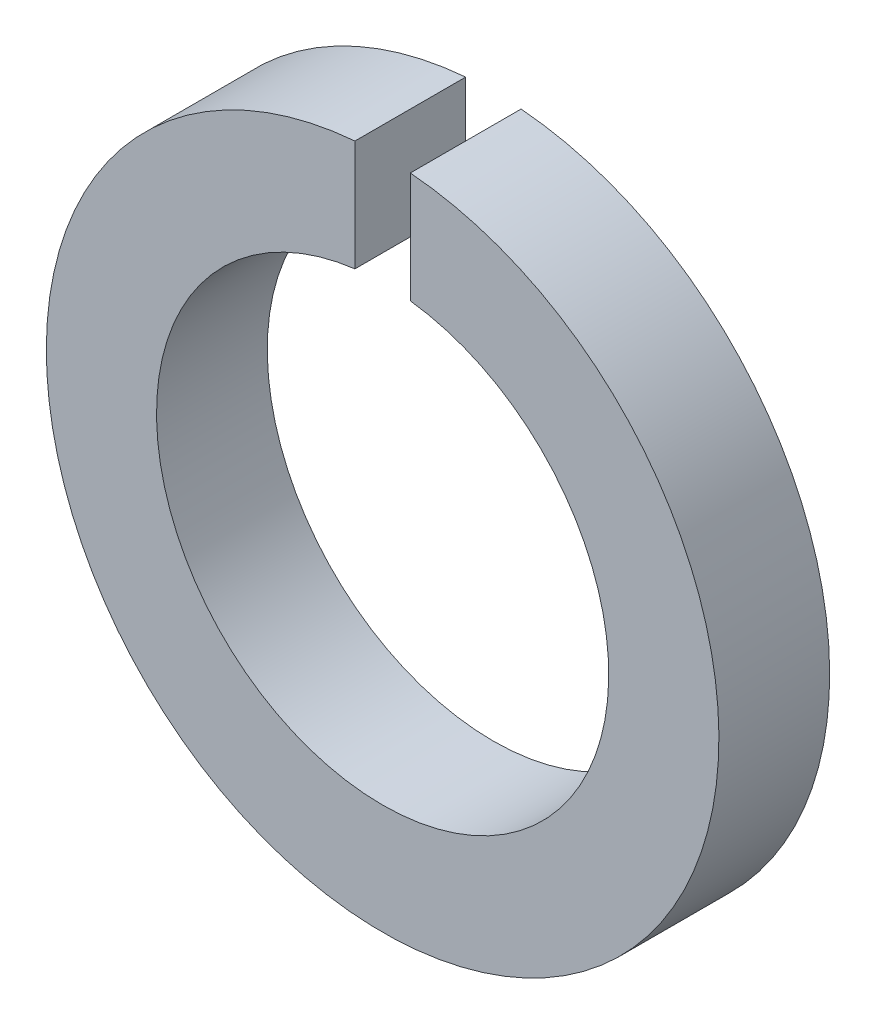
from build123d import *

# Parameters (mm, degrees)
EXTRUDE_1_DEPTH = 6


with BuildPart() as part:
    # 草图1 → 拉伸1 (new body)
    with BuildSketch(Plane.XY):
        with BuildLine():
            Line((-1.5, 18.157816416), (-1.5, 12.157816416))
            ThreePointArc((-1.5, 12.157816416), (0, -12.25), (1.5, 12.157816416))
            Line((1.5, 12.157816416), (1.5, 18.157816416))
            ThreePointArc((1.5, 18.157816416), (0, -18.219667862), (-1.5, 18.157816416))
        make_face()
    extrude(amount=EXTRUDE_1_DEPTH)


solid = part.part
